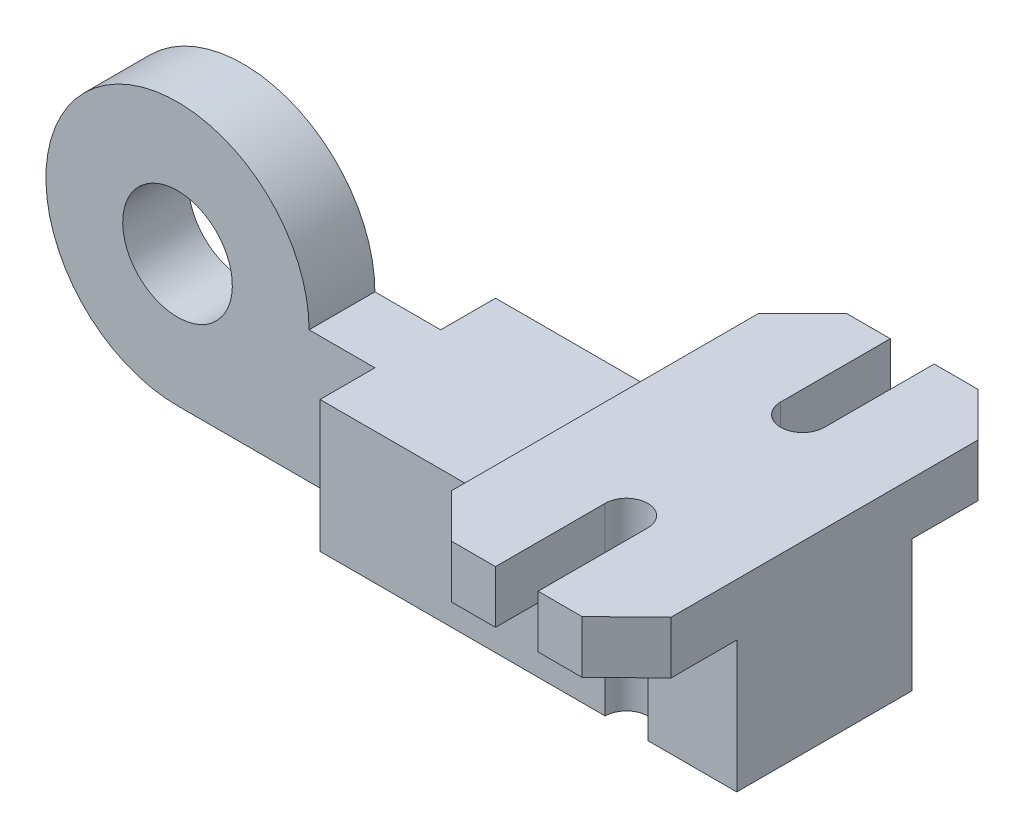
from build123d import *

# Parameters (mm, degrees)
BOSS_EXTRUDE1_DEPTH = 12
SKETCH3_W           = 40
SKETCH3_H           = 30
BOSS_EXTRUDE2_DEPTH = 95
CUT_EXTRUDE1_START  = -95
SKETCH5_R           = 5
SKETCH5_R_2         = 4.855667385
CUT_EXTRUDE1_DEPTH  = 95
SKETCH7_R           = 12.5
BOSS_EXTRUDE3_DEPTH = 15


with BuildPart() as part:
    # Sketch1 → Boss-Extrude1 (new body)
    with BuildSketch(Plane(origin=(0, 0, 0), x_dir=(1, 0, 0), z_dir=(0, 1, 0))):
        with BuildLine():
            Line((-32.581308436, 24.430613363), (-42.581308436, 24.430613363))
            Line((-42.581308436, 24.430613363), (-52.581308436, 14.430613363))
            Line((-52.581308436, 14.430613363), (-52.581308436, -55.569386637))
            Line((-52.581308436, -55.569386637), (-42.581308436, -65.569386637))
            Line((-42.581308436, -65.569386637), (-32.581308436, -65.569386637))
            Line((-32.581308436, -65.569386637), (-32.581308436, -40.569386637))
            ThreePointArc((-32.581308436, -40.569386637), (-27.725641051, -35.713719251), (-22.869973665, -40.569386637))
            Line((-22.869973665, -40.569386637), (-22.869973665, -65.569386637))
            Line((-22.869973665, -65.569386637), (-12.869973665, -65.569386637))
            Line((-12.869973665, -65.569386637), (-2.581308436, -55.569386637))
            Line((-2.581308436, -55.569386637), (-2.581308436, 14.430613363))
            Line((-2.581308436, 14.430613363), (-12.581308436, 24.430613363))
            Line((-12.581308436, 24.430613363), (-22.581308436, 24.430613363))
            Line((-22.581308436, 24.430613363), (-22.581308436, -0.569386637))
            ThreePointArc((-22.581308436, -0.569386637), (-27.581308436, -5.569386637), (-32.581308436, -0.569386637))
            Line((-32.581308436, -0.569386637), (-32.581308436, 24.430613363))
        make_face()
    extrude(amount=BOSS_EXTRUDE1_DEPTH)

    # Sketch3 → Boss-Extrude2 (add)
    with BuildSketch(Plane(origin=(-2.581308436, 0, 0), x_dir=(0, 0, -1), z_dir=(1, 0, 0))):
        with Locations((-20.569386637, -15)):
            Rectangle(SKETCH3_W, SKETCH3_H)
    extrude(amount=-BOSS_EXTRUDE2_DEPTH)

    # Sketch5 → Cut-Extrude1 (cut)
    with BuildSketch(Plane(origin=(0, 12, 0), x_dir=(1, 0, 0), z_dir=(0, 1, 0)).offset(CUT_EXTRUDE1_START)):
        with Locations((-27.581308436, -0.569386637)):
            Circle(SKETCH5_R)
        with Locations((-27.725641051, -40.569386637)):
            Circle(SKETCH5_R_2)
    extrude(amount=CUT_EXTRUDE1_DEPTH, mode=Mode.SUBTRACT)

    # Sketch7 → Boss-Extrude3 (add)
    with BuildSketch(Plane(origin=(0, 0, 13.069386637), x_dir=(-1, 0, 0), z_dir=(0, 0, -1))):
        with BuildLine():
            Line((97.581308436, 0), (112.581308436, 0))
            ThreePointArc((112.581308436, 0), (163.794511872, 21.213203436), (142.581308436, -30))
            Line((142.581308436, -30), (97.581308436, -30))
            Line((97.581308436, -30), (97.581308436, 0))
        make_face()
        with Locations(Location((142.581308436, 0, 0), (0, 0, 90))):
            Circle(SKETCH7_R, mode=Mode.SUBTRACT)
    extrude(amount=-BOSS_EXTRUDE3_DEPTH)


solid = part.part
